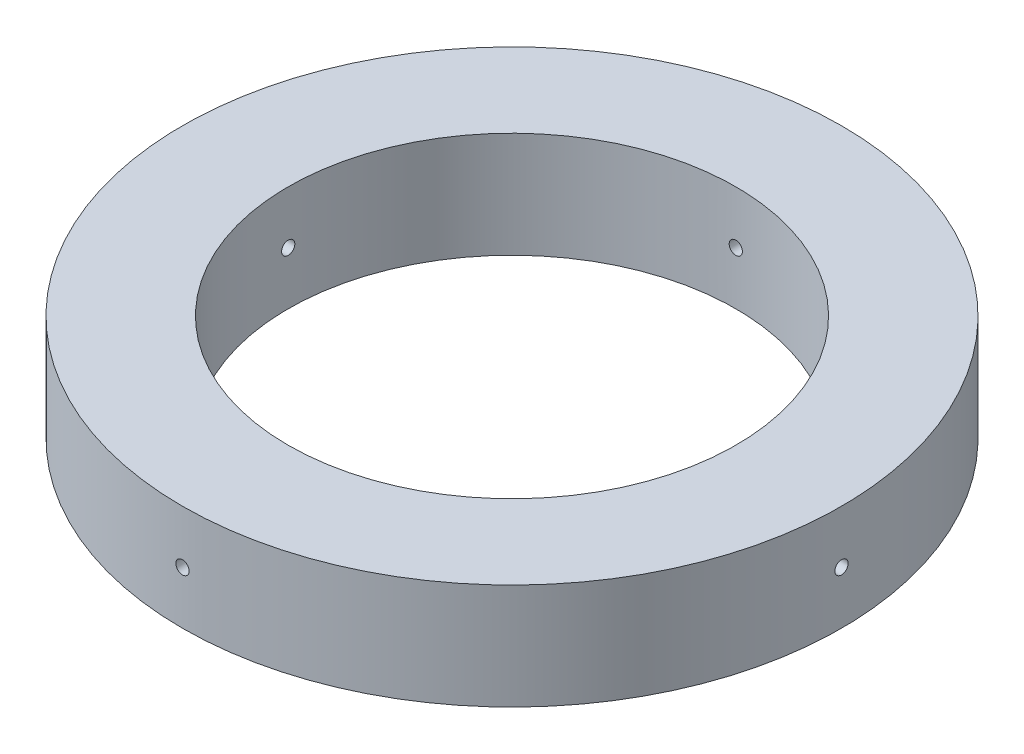
from build123d import *

# Parameters (mm, degrees)
CROQUIS1_R                 = 62.36
CROQUIS1_R_2               = 42.36
SALIENTE_EXTRUIR1_DEPTH    = 20
CORTAR_EXTRUIR1_REACH      = 92.43
CORTAR_EXTRUIR1_END_RADIUS = 62.36
CROQUIS2_R                 = 1.25
MATRIZC1_COUNT             = 4


with BuildPart() as part:
    # Croquis1 → Saliente-Extruir1 (new body)
    with BuildSketch(Plane(origin=(0, 0, 0), x_dir=(1, 0, 0), z_dir=(0, 1, 0))):
        with Locations(Location((0, 0, 0), (0, 0, 270))):
            Circle(CROQUIS1_R)
        with Locations(Location((0, 0, 0), (0, 0, 270))):
            Circle(CROQUIS1_R_2, mode=Mode.SUBTRACT)
    extrude(amount=SALIENTE_EXTRUIR1_DEPTH)

    # Cortar-Extruir1: up to this cylinder (the profile starts inside it)
    cortar_extruir1_end = Plane(origin=(0, 10, 0), z_dir=(0, -1, 0)) * Cylinder(CORTAR_EXTRUIR1_END_RADIUS, 310.58, mode=Mode.PRIVATE)
    # Croquis2 → Cortar-Extruir1 (cut, up to the surface)
    with BuildSketch(Plane.XY, mode=Mode.PRIVATE) as cortar_extruir1_sk1:
        with Locations((0, 10)):
            Circle(CROQUIS2_R)
    cortar_extruir1_tool1 = extrude(cortar_extruir1_sk1.sketch, amount=-CORTAR_EXTRUIR1_REACH, mode=Mode.PRIVATE) & cortar_extruir1_end
    cortar_extruir1 = cortar_extruir1_tool1.solids().sort_by_distance((0, 10, 0))[0]
    add(cortar_extruir1, mode=Mode.SUBTRACT)

    # MatrizC1: Cortar-Extruir1 ×4 about axis
    matrizc1_axis = Axis((0, 20, 0), (0, 1, 0))
    for i in range(1, MATRIZC1_COUNT):
        add(cortar_extruir1.rotate(matrizc1_axis, i * 360 / MATRIZC1_COUNT), mode=Mode.SUBTRACT)


solid = part.part
